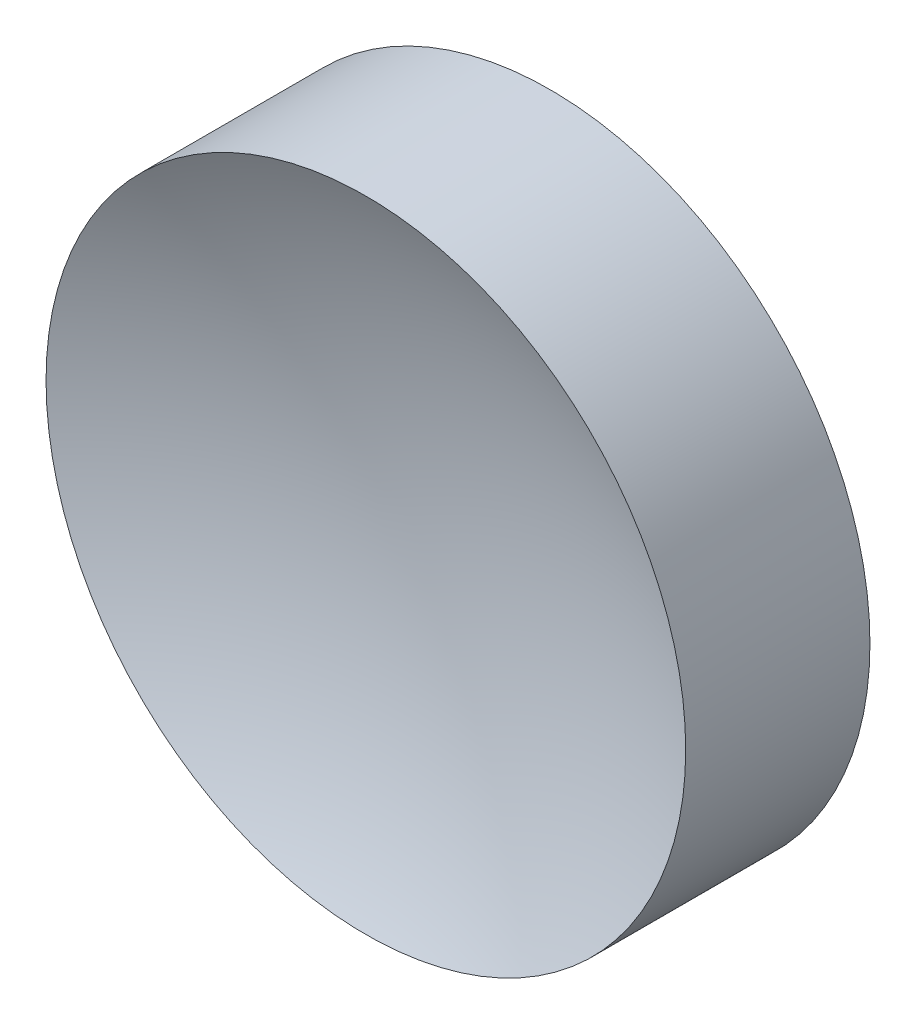
from build123d import *


with BuildPart() as part:
    # 草图1 → 旋转1 (revolve)
    with BuildSketch(Plane(origin=(0, 0, 0), x_dir=(1, 0, 0), z_dir=(0, 1, 0)), mode=Mode.PRIVATE) as revolve_1_sk:
        with BuildLine():
            Line((0, 0), (0, 1.4))
            ThreePointArc((0, 1.4), (-6.156242087, 2.097935091), (-12, 4.156313937))
            Line((-12, 4.156313937), (-12, -2.756313937))
            ThreePointArc((-12, -2.756313937), (-6.156242087, -0.697935091), (0, 0))
        make_face()
    revolve(revolve_1_sk.sketch.rotate(Axis((0, 0, 0), (0, 0, -1)), 180), axis=Axis((0, 0, 0), (0, 0, -1)))


solid = part.part
